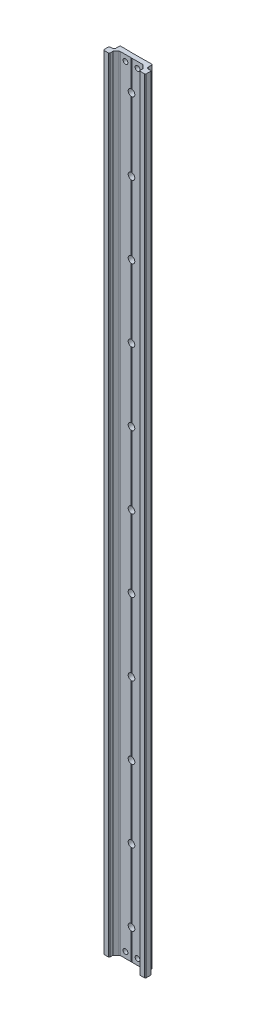
from build123d import *

# Parameters (mm, degrees)
BOSS_EXTRU_1_DEPTH                  = 650
ENL_V_MAT_EXTRU_1_DEPTH             = 651.254758327
ENL_V_MAT_EXTRU_2_DEPTH             = 650
ENL_V_MAT_EXTRU_3_DEPTH             = 651.254758327
ENL_V_MAT_EXTRU_4_DEPTH             = 650
DIAM_TRE_DU_PER_AGE_5_5_5_5_1_D     = 5.5
DIAM_TRE_DU_PER_AGE_5_5_5_5_1_DEPTH = 9.900000103
CHANFREIN1_SIZE2                    = 0.499999975
CHANFREIN1_SIZE                     = 0.5
CHANFREIN2_SIZE                     = 0.3
CHANFREIN3_SIZE2                    = 0.500000028
CHANFREIN3_SIZE                     = 0.499999997
CHANFREIN4_SIZE                     = 0.5
CHANFREIN4_SIZE2                    = 0.500000014
CONG_1_R                            = 1.499999963
CONG_2_R                            = 1.999999944
ESQUISSE8_R                         = 2
ENL_V_MAT_EXTRU_5_DEPTH             = 10


with BuildPart() as part:
    # Esquisse1 → Boss.-Extru.1 (new body)
    with BuildSketch(Plane(origin=(0, 325, 0), x_dir=(1, 0, 0), z_dir=(0, 1, 0))):
        Polygon((-9.70002034, 1.00000045), (9.70002034, 1.00000045), (12.50002072, -1.79999993), (12.50002072, -4.999999928), (17.50002072, -4.999999928), (17.50002072, 5.000000175), (-17.50002072, 5.000000175), (-17.50002072, -4.999999928), (-12.50002072, -4.999999928), (-12.50002072, -1.79999993), align=None)
    extrude(amount=-BOSS_EXTRU_1_DEPTH)

    # Esquisse2 → Enlèv. mat.-Extru.1 (cut, through all)
    with BuildSketch(Plane.XZ.offset(325)):
        Polygon((-14.30002069, -6.7e-08), (-17.50002072, -6.7e-08), (-17.50002072, -5.000000175), (-13.50002072, -5.000000175), (-13.50002072, -0.799999947), align=None)
    extrude(amount=-ENL_V_MAT_EXTRU_1_DEPTH, mode=Mode.SUBTRACT)

    # Esquisse3 → Enlèv. mat.-Extru.2 (cut)
    with BuildSketch(Plane.XZ.offset(325)):
        Polygon((0.25, -1.000000175), (-0.25, -1.000000175), (1e-09, -1.144337743), align=None)
    extrude(amount=-ENL_V_MAT_EXTRU_2_DEPTH, mode=Mode.SUBTRACT)

    # Esquisse4 → Enlèv. mat.-Extru.3 (cut, through all)
    with BuildSketch(Plane.XZ.offset(325)):
        Polygon((13.50002072, -0.799999925), (13.50002072, -5.000000175), (17.50002072, -5.000000175), (17.50002072, 7.5e-08), (14.30002072, 7.5e-08), align=None)
    extrude(amount=-ENL_V_MAT_EXTRU_3_DEPTH, mode=Mode.SUBTRACT)

    # Esquisse5 → Enlèv. mat.-Extru.4 (cut)
    with BuildSketch(Plane.XZ.offset(325)):
        Polygon((-7.50002072, -5.000000175), (7.50002072, -5.000000175), (7.40002072, -4.900000175), (-7.40002072, -4.900000175), align=None)
    extrude(amount=-ENL_V_MAT_EXTRU_4_DEPTH, mode=Mode.SUBTRACT)

    # Diamètre du perçage Ø5.5 (5.5)1
    with Locations(Plane(origin=(0, 0, -4.900000175), x_dir=(-1, 0, 0), z_dir=(0, 0, -1))):
        with Locations((0, 300), (0, 240), (0, 180), (0, 120), (0, 60), (0, 0), (0, -60), (0, -120), (0, -180), (0, -240), (0, -300)):
            Hole(DIAM_TRE_DU_PER_AGE_5_5_5_5_1_D / 2, depth=DIAM_TRE_DU_PER_AGE_5_5_5_5_1_DEPTH)

    # Chanfrein1
    chanfrein1_edges = [part.edges().sort_by_distance(p)[0] for p in [
        (-17.50002072, 0, 4.999999928),
        (17.50002072, 0, 4.999999928),
    ]]
    chamfer(chanfrein1_edges, length=CHANFREIN1_SIZE, length2=CHANFREIN1_SIZE2)

    # Chanfrein2
    chanfrein2_edges = [part.edges().sort_by_distance(p)[0] for p in [
        (-13.50002072, 0, -5.000000175),
        (13.50002072, 0, -5.000000175),
    ]]
    chamfer(chanfrein2_edges, length=CHANFREIN2_SIZE)

    # Chanfrein3
    chanfrein3_edges = [part.edges().sort_by_distance(p)[0] for p in [
        (-12.50002072, 0, 4.999999928),
        (12.50002072, 0, 4.999999928),
        (-17.50002072, 0, -6.7e-08),
    ]]
    chamfer(chanfrein3_edges, length=CHANFREIN3_SIZE, length2=CHANFREIN3_SIZE2)

    # Chanfrein4
    chanfrein4_edges = [part.edges().sort_by_distance(p)[0] for p in [
        (17.50002072, 0, 7.5e-08),
    ]]
    chanfrein4_side = [part.faces().sort_by_distance(p)[0] for p in [
        (15.90002072, 0, 7.5e-08),
    ]]
    chamfer(chanfrein4_edges, length=CHANFREIN4_SIZE, length2=CHANFREIN4_SIZE2, reference=chanfrein4_side[0])

    # Congé1
    cong_1_edges = [part.edges().sort_by_distance(p)[0] for p in [
        (9.70002034, 0, -1.00000045),
        (-9.70002034, 0, -1.00000045),
    ]]
    fillet(cong_1_edges, radius=CONG_1_R)

    # Congé2
    cong_2_edges = [part.edges().sort_by_distance(p)[0] for p in [
        (-13.50002072, 0, -0.799999947),
        (13.50002072, 0, -0.799999925),
    ]]
    fillet(cong_2_edges, radius=CONG_2_R)

    # Esquisse8 → Enlèv. mat.-Extru.5 (cut)
    with BuildSketch(Plane.XY.offset(-1.00000045)):
        with Locations((-4.999999999, -320)):
            Circle(ESQUISSE8_R)
        with Locations((5.000000001, -320)):
            Circle(ESQUISSE8_R)
        with Locations((-4.999999999, 320)):
            Circle(ESQUISSE8_R)
        with Locations((5.000000001, 320)):
            Circle(ESQUISSE8_R)
    extrude(amount=-ENL_V_MAT_EXTRU_5_DEPTH, mode=Mode.SUBTRACT)


solid = part.part
